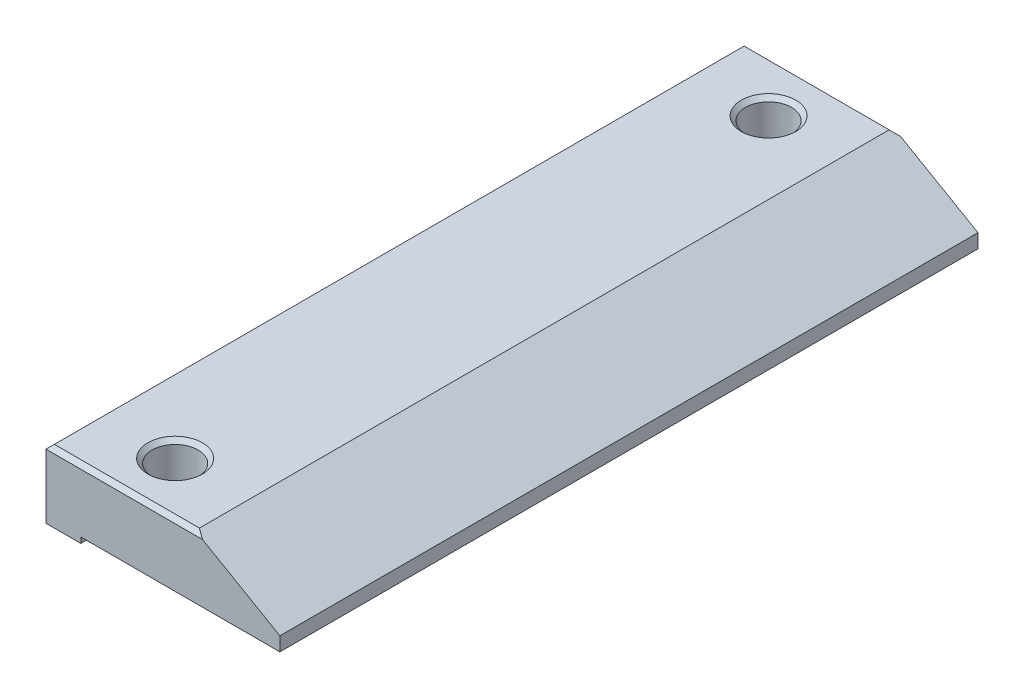
from build123d import *

# Parameters (mm, degrees)
BOSS_EXTRUDE1_DEPTH  = 100
M6_CLEARANCE_HOLE2_D = 6.6
CHAMFER1_SIZE        = 0.6


with BuildPart() as part:
    # Sketch1 → Boss-Extrude1 (new body)
    with BuildSketch(Plane.XY):
        Polygon((-61, 0), (-56, 0), (-56, 0.8), (-27.5, 0.8), (-27.5, 2.8), (-39.624355653, 9.8), (-61, 9.8), align=None)
    extrude(amount=BOSS_EXTRUDE1_DEPTH)

    # M6 Clearance Hole2 (through all)
    with Locations(Plane(origin=(0, 9.8, 0), x_dir=(1, 0, 0), z_dir=(0, 1, 0))):
        with Locations((-50, -92.5), (-50, -7.5)):
            Hole(M6_CLEARANCE_HOLE2_D / 2)

    # Chamfer1
    chamfer1_edges = [part.edges().sort_by_distance(p)[0] for p in [
        (-61, 9.8, 50),
        (-46.7, 9.8, 92.5),
        (-50.312177826, 9.8, 100),
        (-46.7, 9.8, 7.5),
        (-50.312177826, 9.8, 0),
    ]]
    chamfer(chamfer1_edges, length=CHAMFER1_SIZE)


solid = part.part
